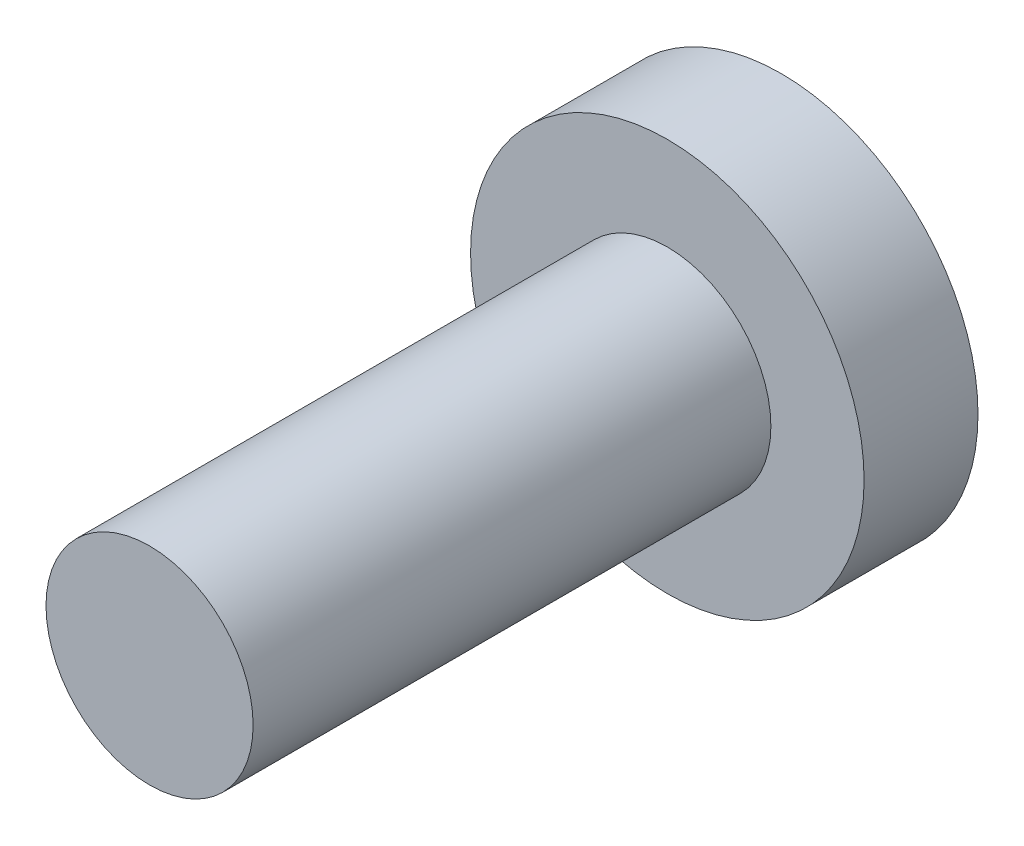
from build123d import *

# Parameters (mm, degrees)
SKETCH_1_R      = 3.8
EXTRUDE_1_DEPTH = 2.2
SKETCH_2_R      = 2
EXTRUDE_2_DEPTH = 10


with BuildPart() as part:
    # 草图1 → 凸台-拉伸1 (new body)
    with BuildSketch(Plane.XY):
        Circle(SKETCH_1_R)
    extrude(amount=EXTRUDE_1_DEPTH)

    # 草图2 → 凸台-拉伸2 (add)
    with BuildSketch(Plane.XY.offset(2.2)):
        Circle(SKETCH_2_R)
    extrude(amount=EXTRUDE_2_DEPTH)


solid = part.part
